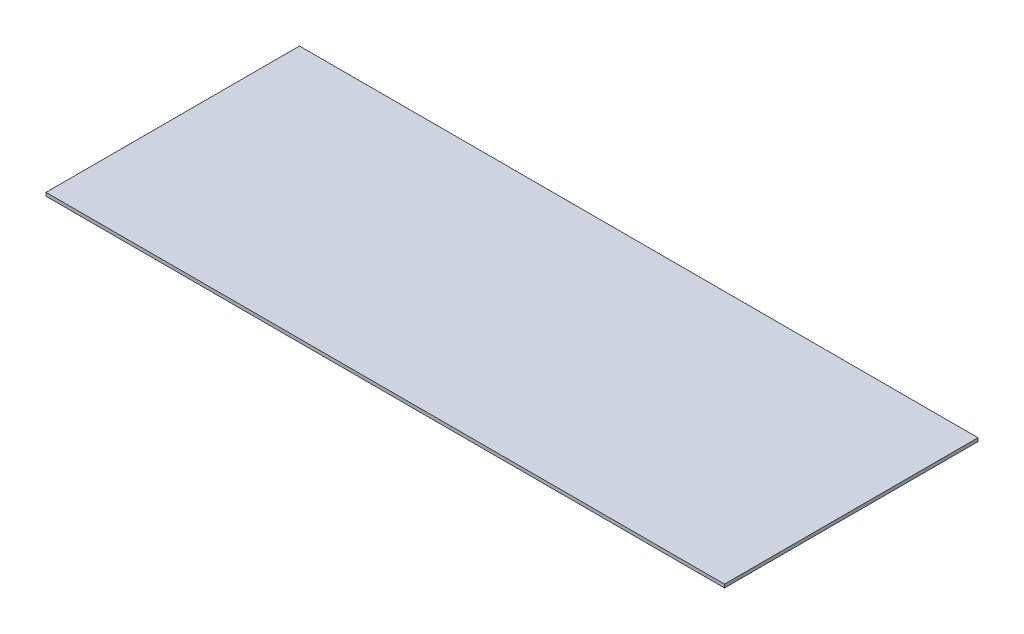
from build123d import *

# Parameters (mm, degrees)
SKIZZE1_W                       = 803
SKIZZE1_H                       = 4
AUFSATZ_LINEAR_AUSTRAGEN1_DEPTH = 300


with BuildPart() as part:
    # Skizze1 → Aufsatz-Linear austragen1 (new body)
    with BuildSketch(Plane.XY):
        with Locations((0, 2)):
            Rectangle(SKIZZE1_W, SKIZZE1_H)
    extrude(amount=AUFSATZ_LINEAR_AUSTRAGEN1_DEPTH)


solid = part.part
